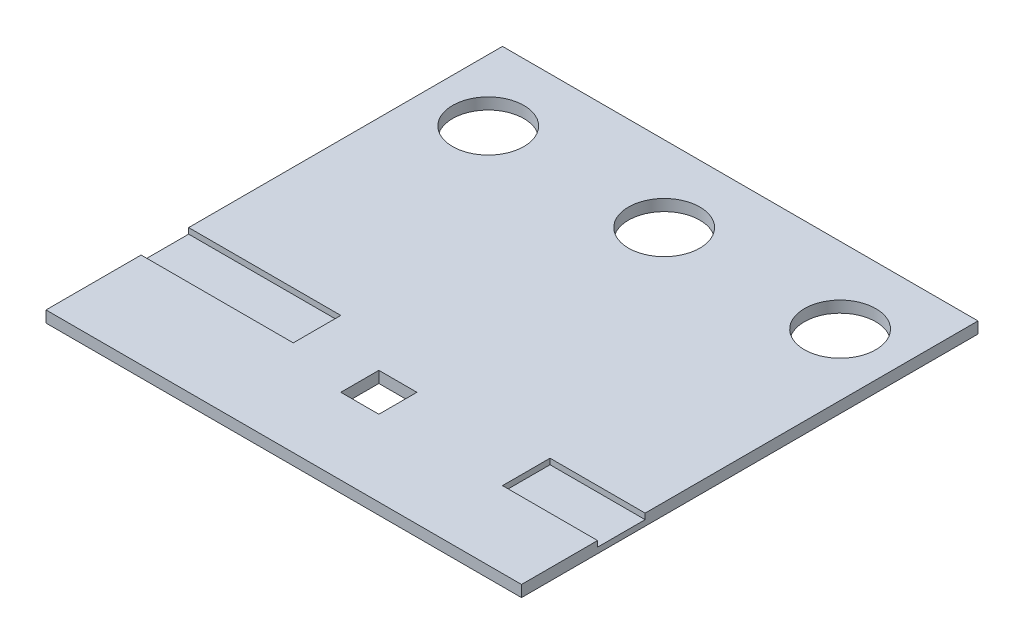
from build123d import *

# Parameters (mm, degrees)
SKETCH1_W           = 4
SKETCH1_H           = 4
SKETCH1_R           = 3.7500052
BOSS_EXTRUDE1_DEPTH = 1.2
SKETCH1_5_W         = 16
SKETCH1_5_H         = 5
SKETCH1_5_W_2       = 10
BOSS_EXTRUDE3_DEPTH = 0.6


with BuildPart() as part:
    # Sketch1 → Boss-Extrude1 (new body)
    with BuildSketch(Plane(origin=(0, 0, 0), x_dir=(1, 0, 0), z_dir=(0, 1, 0))):
        Polygon((-25, -30), (-25, -40), (25, -40), (25, -32), (15, -32), (15, -27), (25, -27), (25, 8), (-25, 8), (-25, -25), (-9, -25), (-9, -30), align=None)
        with Locations((0, -30)):
            Rectangle(SKETCH1_W, SKETCH1_H, mode=Mode.SUBTRACT)
        with Locations((-18.5, 0)):
            Circle(SKETCH1_R, mode=Mode.SUBTRACT)
        Circle(SKETCH1_R, mode=Mode.SUBTRACT)
        with Locations((18.5, 0)):
            Circle(SKETCH1_R, mode=Mode.SUBTRACT)
    extrude(amount=BOSS_EXTRUDE1_DEPTH)

    # Sketch1<5> → Boss-Extrude3 (add)
    with BuildSketch(Plane(origin=(0, 0, 0), x_dir=(1, 0, 0), z_dir=(0, 1, 0))):
        with Locations((-17, -27.5)):
            Rectangle(SKETCH1_5_W, SKETCH1_5_H)
        with Locations((20, -29.5)):
            Rectangle(SKETCH1_5_W_2, SKETCH1_5_H)
    extrude(amount=BOSS_EXTRUDE3_DEPTH)


solid = part.part
